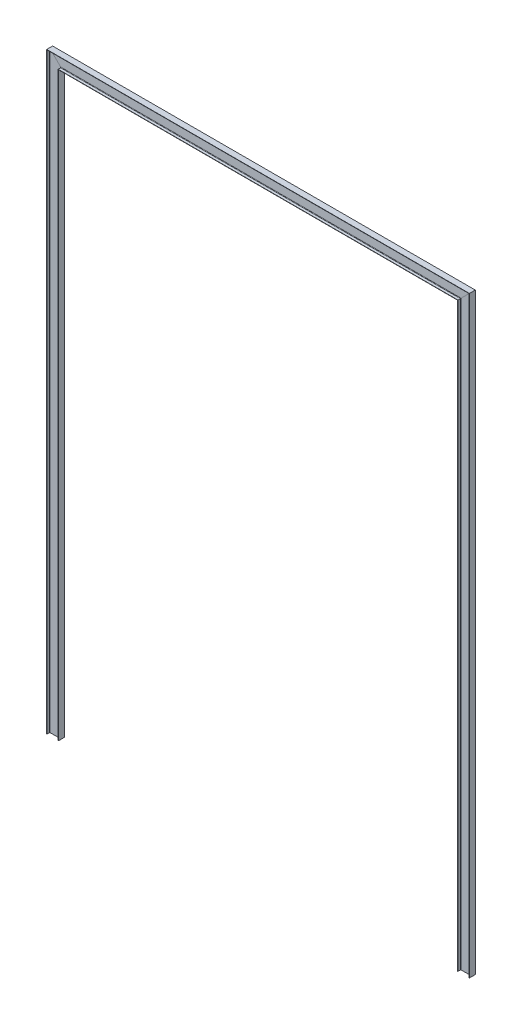
from build123d import *

# Parameters (mm, degrees)
W_SECTION_W8X10_1_DEPTH   = 10113.001976112
W_SECTION_W8X10_1_2_DEPTH = 7226.003952224
W_SECTION_W8X10_1_3_DEPTH = 10113.001976113


with BuildPart() as part:
    # Sketch11 → W section W8X10(1) (new body)
    with BuildSketch(Plane.ZX):
        with BuildLine():
            Line((-50.038, -100.203), (-50.038, -94.996))
            Line((-50.038, -94.996), (-9.779, -94.996))
            ThreePointArc((-9.779, -94.996), (-4.390846327, -92.764153673), (-2.159, -87.376))
            Line((-2.159, -87.376), (-2.159, 87.376))
            ThreePointArc((-2.159, 87.376), (-4.390846327, 92.764153673), (-9.779, 94.996))
            Line((-9.779, 94.996), (-50.038, 94.996))
            Line((-50.038, 94.996), (-50.038, 100.203))
            Line((-50.038, 100.203), (50.038, 100.203))
            Line((50.038, 100.203), (50.038, 94.996))
            Line((50.038, 94.996), (9.779, 94.996))
            ThreePointArc((9.779, 94.996), (4.390846327, 92.764153673), (2.159, 87.376))
            Line((2.159, 87.376), (2.159, -87.376))
            ThreePointArc((2.159, -87.376), (4.390846327, -92.764153673), (9.779, -94.996))
            Line((9.779, -94.996), (50.038, -94.996))
            Line((50.038, -94.996), (50.038, -100.203))
            Line((50.038, -100.203), (-50.038, -100.203))
        make_face()
    extrude(amount=W_SECTION_W8X10_1_DEPTH)

    # W section W8X10(1) mitre 1
    split(bisect_by=Plane(origin=(0, 10000, 0), x_dir=(0.707106781, -0.707106781, 0), z_dir=(-0.707106781, -0.707106781, 0)), keep=Keep.TOP)


with BuildPart() as body_2:
    # Sketch11 on segment 2 (carried to segment 2) → W section W8X10_1 2 (new body)
    with BuildSketch(Plane(origin=(-113.001976112, 10000, 0), x_dir=(0, 0, 1), z_dir=(1, 0, 0))):
        with BuildLine():
            Line((-50.038, -100.203), (-50.038, -94.996))
            Line((-50.038, -94.996), (-9.779, -94.996))
            ThreePointArc((-9.779, -94.996), (-4.390846327, -92.764153673), (-2.159, -87.376))
            Line((-2.159, -87.376), (-2.159, 87.376))
            ThreePointArc((-2.159, 87.376), (-4.390846327, 92.764153673), (-9.779, 94.996))
            Line((-9.779, 94.996), (-50.038, 94.996))
            Line((-50.038, 94.996), (-50.038, 100.203))
            Line((-50.038, 100.203), (50.038, 100.203))
            Line((50.038, 100.203), (50.038, 94.996))
            Line((50.038, 94.996), (9.779, 94.996))
            ThreePointArc((9.779, 94.996), (4.390846327, 92.764153673), (2.159, 87.376))
            Line((2.159, 87.376), (2.159, -87.376))
            ThreePointArc((2.159, -87.376), (4.390846327, -92.764153673), (9.779, -94.996))
            Line((9.779, -94.996), (50.038, -94.996))
            Line((50.038, -94.996), (50.038, -100.203))
            Line((50.038, -100.203), (-50.038, -100.203))
        make_face()
    extrude(amount=W_SECTION_W8X10_1_2_DEPTH)

    # W section W8X10_1 2 mitre 1
    split(bisect_by=Plane(origin=(0, 10000, 0), x_dir=(-0.707106781, 0.707106781, 0), z_dir=(0.707106781, 0.707106781, 0)), keep=Keep.TOP)

    # W section W8X10_1 2 mitre 2
    split(bisect_by=Plane(origin=(7000, 10000, 0), x_dir=(-0.707106781, -0.707106781, 0), z_dir=(-0.707106781, 0.707106781, 0)), keep=Keep.TOP)


with BuildPart() as body_3:
    # Sketch11 on segment 3 (carried to segment 3) → W section W8X10_1 3 (new body)
    with BuildSketch(Plane(origin=(7000, 10113.001976112, 0), x_dir=(0, 0, 1), z_dir=(0, -1, 0))):
        with BuildLine():
            Line((-50.038, -100.203), (-50.038, -94.996))
            Line((-50.038, -94.996), (-9.779, -94.996))
            ThreePointArc((-9.779, -94.996), (-4.390846327, -92.764153673), (-2.159, -87.376))
            Line((-2.159, -87.376), (-2.159, 87.376))
            ThreePointArc((-2.159, 87.376), (-4.390846327, 92.764153673), (-9.779, 94.996))
            Line((-9.779, 94.996), (-50.038, 94.996))
            Line((-50.038, 94.996), (-50.038, 100.203))
            Line((-50.038, 100.203), (50.038, 100.203))
            Line((50.038, 100.203), (50.038, 94.996))
            Line((50.038, 94.996), (9.779, 94.996))
            ThreePointArc((9.779, 94.996), (4.390846327, 92.764153673), (2.159, 87.376))
            Line((2.159, 87.376), (2.159, -87.376))
            ThreePointArc((2.159, -87.376), (4.390846327, -92.764153673), (9.779, -94.996))
            Line((9.779, -94.996), (50.038, -94.996))
            Line((50.038, -94.996), (50.038, -100.203))
            Line((50.038, -100.203), (-50.038, -100.203))
        make_face()
    extrude(amount=W_SECTION_W8X10_1_3_DEPTH)

    # W section W8X10_1 3 mitre 1
    split(bisect_by=Plane(origin=(7000, 10000, 0), x_dir=(0.707106781, 0.707106781, 0), z_dir=(0.707106781, -0.707106781, 0)), keep=Keep.TOP)


solid = Compound([part.part, body_2.part, body_3.part])
